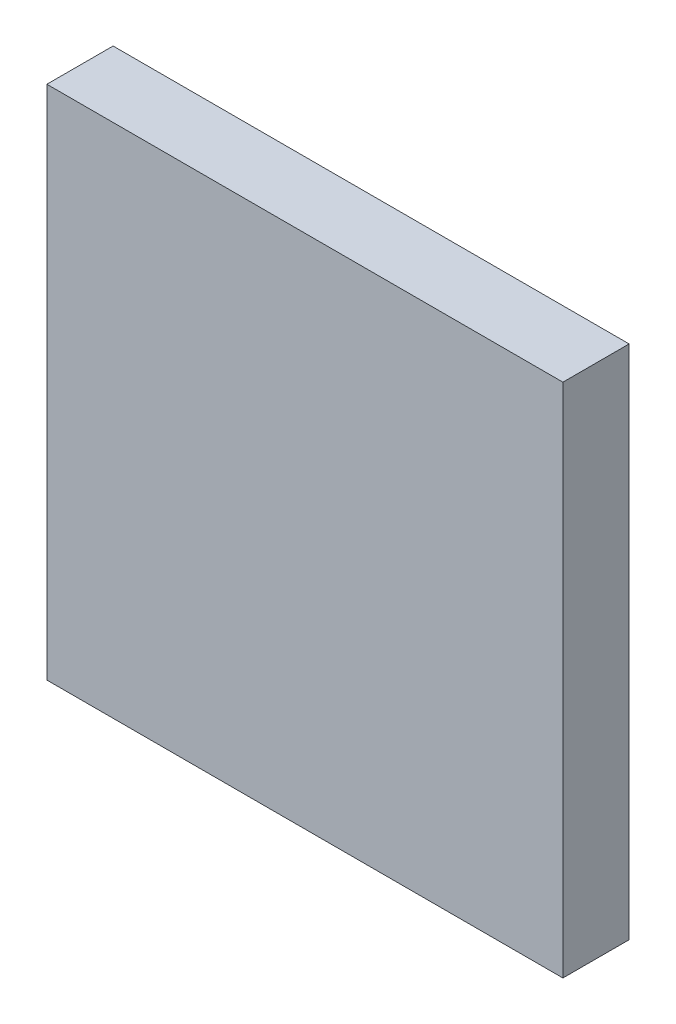
from build123d import *

# Parameters (mm, degrees)
SKETCH_1_W       = 100
SKETCH_1_H       = 100
EXTRUDE_1_DEPTH  = 1.6
SKETCH_4_W       = 17.78
SKETCH_4_H       = 2.5
SKETCH_4_W_2     = 2.5
SKETCH_4_H_2     = 17.78
EXTRUDE_2_DEPTH  = 2.5
SKETCH_5_W       = 0.64
SKETCH_5_H       = 0.64
EXTRUDE_3_DEPTH  = 6.1
SKETCH_6_W       = 3.48
SKETCH_6_H       = 3.48
EXTRUDE_4_DEPTH  = 2
SKETCH_7_W       = 2
SKETCH_7_H       = 4
SKETCH_7_W_2     = 4
SKETCH_7_H_2     = 2
EXTRUDE_5_DEPTH  = 1.1
SKETCH_8_W       = 15.2
SKETCH_8_H       = 7.4
EXTRUDE_6_DEPTH  = 2.65
SKETCH_9_W       = 7.62
SKETCH_9_H       = 2.5
EXTRUDE_7_DEPTH  = 2.5
SKETCH_11_W      = 0.64
SKETCH_11_H      = 0.64
EXTRUDE_8_DEPTH  = 6.1
SKETCH_16_W      = 10.16
SKETCH_16_H      = 2.5
EXTRUDE_12_DEPTH = 2.5
SKETCH_17_W      = 0.64
SKETCH_17_H      = 0.64
EXTRUDE_13_DEPTH = 6.1
SKETCH_15_W      = 120
SKETCH_15_H      = 120
EXTRUDE_11_DEPTH = 15.4


with BuildPart() as part:
    # ｽｹｯﾁ1 → ﾎﾞｽ - 押し出し1 (new body)
    with BuildSketch(Plane.XY):
        Rectangle(SKETCH_1_W, SKETCH_1_H)
    extrude(amount=EXTRUDE_1_DEPTH)

    # ｽｹｯﾁ4 → ﾎﾞｽ - 押し出し2 (add)
    with BuildSketch(Plane(origin=(0, 0, 0), x_dir=(-1, 0, 0), z_dir=(0, 0, -1))):
        with Locations((20, -42.6)):
            Rectangle(SKETCH_4_W, SKETCH_4_H)
        with Locations((-42.6, -20)):
            Rectangle(SKETCH_4_W_2, SKETCH_4_H_2)
        with Locations((-20, 42.6)):
            Rectangle(SKETCH_4_W, SKETCH_4_H)
        with Locations((42.6, 20)):
            Rectangle(SKETCH_4_W_2, SKETCH_4_H_2)
    extrude(amount=EXTRUDE_2_DEPTH)

    # ｽｹｯﾁ5 → ﾎﾞｽ - 押し出し3 (add)
    with BuildSketch(Plane(origin=(0, 0, -2.5), x_dir=(-1, 0, 0), z_dir=(0, 0, -1))):
        with Locations((-20, 42.6)):
            Rectangle(SKETCH_5_W, SKETCH_5_H)
        with Locations((-17.46, 42.6)):
            Rectangle(SKETCH_5_W, SKETCH_5_H)
        with Locations((-14.92, 42.6)):
            Rectangle(SKETCH_5_W, SKETCH_5_H)
        with Locations((-12.38, 42.6)):
            Rectangle(SKETCH_5_W, SKETCH_5_H)
        with Locations((-22.54, 42.6)):
            Rectangle(SKETCH_5_W, SKETCH_5_H)
        with Locations((-25.08, 42.6)):
            Rectangle(SKETCH_5_W, SKETCH_5_H)
        with Locations((-27.62, 42.6)):
            Rectangle(SKETCH_5_W, SKETCH_5_H)
        with Locations((-42.6, -20)):
            Rectangle(SKETCH_5_W, SKETCH_5_H)
        with Locations((-42.6, -22.54)):
            Rectangle(SKETCH_5_W, SKETCH_5_H)
        with Locations((42.6, 20)):
            Rectangle(SKETCH_5_W, SKETCH_5_H)
        with Locations((-42.6, -25.08)):
            Rectangle(SKETCH_5_W, SKETCH_5_H)
        with Locations((-42.6, -27.62)):
            Rectangle(SKETCH_5_W, SKETCH_5_H)
        with Locations((-42.6, -17.46)):
            Rectangle(SKETCH_5_W, SKETCH_5_H)
        with Locations((-42.6, -14.92)):
            Rectangle(SKETCH_5_W, SKETCH_5_H)
        with Locations((-42.6, -12.38)):
            Rectangle(SKETCH_5_W, SKETCH_5_H)
        with Locations((42.6, 17.46)):
            Rectangle(SKETCH_5_W, SKETCH_5_H)
        with Locations((42.6, 14.92)):
            Rectangle(SKETCH_5_W, SKETCH_5_H)
        with Locations((42.6, 12.38)):
            Rectangle(SKETCH_5_W, SKETCH_5_H)
        with Locations((42.6, 22.54)):
            Rectangle(SKETCH_5_W, SKETCH_5_H)
        with Locations((42.6, 25.08)):
            Rectangle(SKETCH_5_W, SKETCH_5_H)
        with Locations((42.6, 27.62)):
            Rectangle(SKETCH_5_W, SKETCH_5_H)
        with Locations((20, -42.6)):
            Rectangle(SKETCH_5_W, SKETCH_5_H)
        with Locations((17.46, -42.6)):
            Rectangle(SKETCH_5_W, SKETCH_5_H)
        with Locations((14.92, -42.6)):
            Rectangle(SKETCH_5_W, SKETCH_5_H)
        with Locations((12.38, -42.6)):
            Rectangle(SKETCH_5_W, SKETCH_5_H)
        with Locations((22.54, -42.6)):
            Rectangle(SKETCH_5_W, SKETCH_5_H)
        with Locations((25.08, -42.6)):
            Rectangle(SKETCH_5_W, SKETCH_5_H)
        with Locations((27.62, -42.6)):
            Rectangle(SKETCH_5_W, SKETCH_5_H)
    extrude(amount=EXTRUDE_3_DEPTH)

    # ｽｹｯﾁ6 → ﾎﾞｽ - 押し出し4 (add)
    with BuildSketch(Plane.XY.offset(1.6)):
        with Locations((-35, -35)):
            Rectangle(SKETCH_6_W, SKETCH_6_H)
        with Locations((-35, 35)):
            Rectangle(SKETCH_6_W, SKETCH_6_H)
        with Locations((35, -35)):
            Rectangle(SKETCH_6_W, SKETCH_6_H)
        with Locations((35, 35)):
            Rectangle(SKETCH_6_W, SKETCH_6_H)
    extrude(amount=EXTRUDE_4_DEPTH)

    # ｽｹｯﾁ7 → ﾎﾞｽ - 押し出し5 (add)
    with BuildSketch(Plane.XY.offset(1.6)):
        with Locations((-37.5, 0)):
            Rectangle(SKETCH_7_W, SKETCH_7_H)
        with Locations((37.5, 0)):
            Rectangle(SKETCH_7_W, SKETCH_7_H)
        with Locations((0, 37.5)):
            Rectangle(SKETCH_7_W_2, SKETCH_7_H_2)
        with Locations((0, -37.5)):
            Rectangle(SKETCH_7_W_2, SKETCH_7_H_2)
        Rectangle(SKETCH_7_W, SKETCH_7_H)
    extrude(amount=EXTRUDE_5_DEPTH)

    # ｽｹｯﾁ8 → ﾎﾞｽ - 押し出し6 (add)
    with BuildSketch(Plane.XY.offset(1.6)):
        with Locations((0, -17)):
            Rectangle(SKETCH_8_W, SKETCH_8_H)
    extrude(amount=EXTRUDE_6_DEPTH)

    # ｽｹｯﾁ9 → ﾎﾞｽ - 押し出し7 (add)
    with BuildSketch(Plane(origin=(0, 0, 0), x_dir=(-1, 0, 0), z_dir=(0, 0, -1))):
        with Locations((-0.8, 18.58)):
            Rectangle(SKETCH_9_W, SKETCH_9_H)
    extrude(amount=EXTRUDE_7_DEPTH)

    # ｽｹｯﾁ11 → ﾎﾞｽ - 押し出し8 (add)
    with BuildSketch(Plane(origin=(0, 0, -2.5), x_dir=(-1, 0, 0), z_dir=(0, 0, -1))):
        with Locations((-0.8, 18.58)):
            Rectangle(SKETCH_11_W, SKETCH_11_H)
        with Locations((-3.34, 18.58)):
            Rectangle(SKETCH_11_W, SKETCH_11_H)
        with Locations((1.74, 18.58)):
            Rectangle(SKETCH_11_W, SKETCH_11_H)
    extrude(amount=EXTRUDE_8_DEPTH)

    # ｽｹｯﾁ16 → ﾎﾞｽ - 押し出し12 (add)
    with BuildSketch(Plane(origin=(0, 0, 0), x_dir=(-1, 0, 0), z_dir=(0, 0, -1))):
        with Locations((0, -31)):
            Rectangle(SKETCH_16_W, SKETCH_16_H)
    extrude(amount=EXTRUDE_12_DEPTH)

    # ｽｹｯﾁ17 → ﾎﾞｽ - 押し出し13 (add)
    with BuildSketch(Plane(origin=(0, 0, -2.5), x_dir=(-1, 0, 0), z_dir=(0, 0, -1))):
        with Locations((-3.81, -31)):
            Rectangle(SKETCH_17_W, SKETCH_17_H)
        with Locations((-1.27, -31)):
            Rectangle(SKETCH_17_W, SKETCH_17_H)
        with Locations((1.27, -31)):
            Rectangle(SKETCH_17_W, SKETCH_17_H)
        with Locations((3.81, -31)):
            Rectangle(SKETCH_17_W, SKETCH_17_H)
    extrude(amount=EXTRUDE_13_DEPTH)


with BuildPart() as body_2:
    # ｽｹｯﾁ15 → ﾎﾞｽ - 押し出し11 (new body)
    with BuildSketch(Plane(origin=(0, 0, -2.5), x_dir=(-1, 0, 0), z_dir=(0, 0, -1))):
        Rectangle(SKETCH_15_W, SKETCH_15_H)
    extrude(amount=-EXTRUDE_11_DEPTH)


solid = Compound([part.part, body_2.part])
